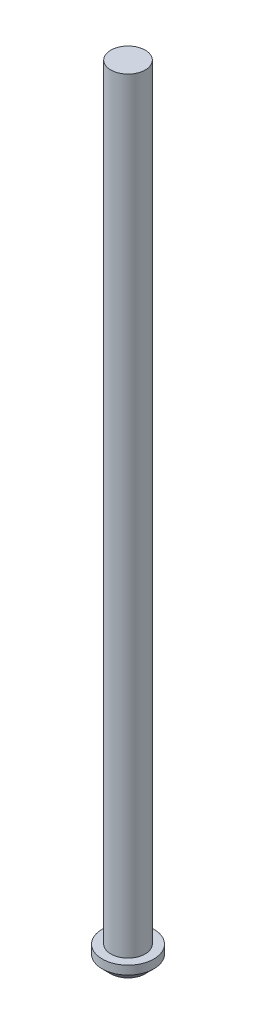
from build123d import *

# Parameters (mm, degrees)
SKETCH1_R           = 2
BOSS_EXTRUDE1_DEPTH = 89
SKETCH2_R           = 3
BOSS_EXTRUDE2_DEPTH = 2
CHAMFER1_SIZE       = 1


with BuildPart() as part:
    # Sketch1 → Boss-Extrude1 (new body)
    with BuildSketch(Plane(origin=(0, 0, 0), x_dir=(1, 0, 0), z_dir=(0, 1, 0))):
        with Locations(Location((0, 0, 0), (0, 0, 270))):
            Circle(SKETCH1_R)
    extrude(amount=BOSS_EXTRUDE1_DEPTH)

    # Sketch2 → Boss-Extrude2 (add)
    with BuildSketch(Plane.XZ):
        with Locations(Location((0, 0, 0), (0, 0, 270))):
            Circle(SKETCH2_R)
    extrude(amount=BOSS_EXTRUDE2_DEPTH)

    # Chamfer1
    chamfer1_edges = [part.edges().sort_by_distance(p)[0] for p in [
        (0, -2, 3),
    ]]
    chamfer(chamfer1_edges, length=CHAMFER1_SIZE)


solid = part.part
